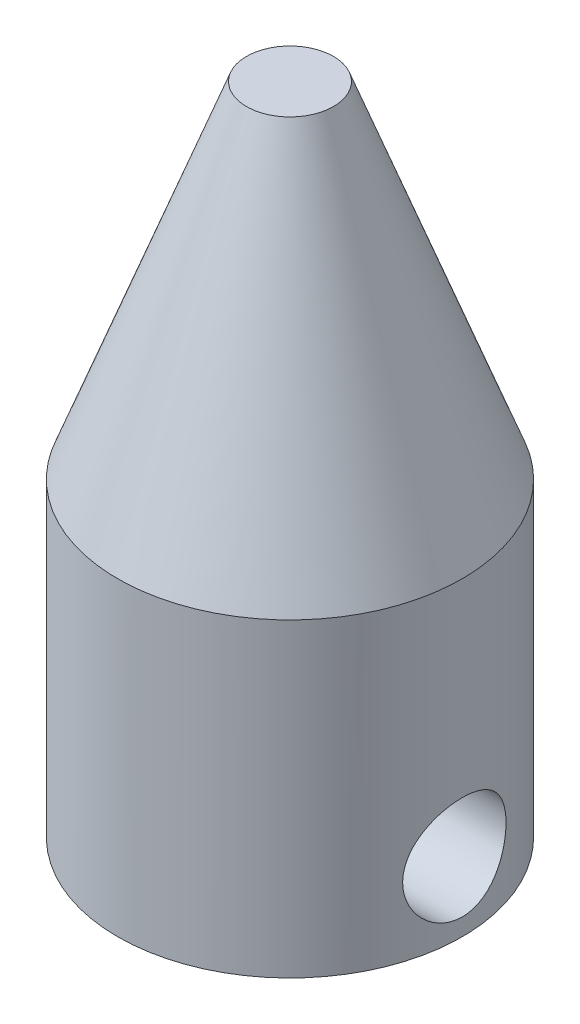
from build123d import *

# Parameters (mm, degrees)
SKETCH1_R             = 5
BODY_DEPTH            = 9
PIN_INSERT_DEPTH      = 12.445523142
PIN_INSERT_DEPTH_BACK = 12.445523142
SKETCH2_R             = 1.5
HEAD_SA_R             = 1.262


with BuildPart() as part:
    # Sketch1 → body (new body)
    with BuildSketch(Plane(origin=(0, 0, 0), x_dir=(1, 0, 0), z_dir=(0, 1, 0))):
        with Locations(Location((0, 0, 0), (0, 0, 270))):
            Circle(SKETCH1_R)
    extrude(amount=BODY_DEPTH)

    # Sketch2 → pin insert (cut, two sides: drawn at the far end of the back side and taken through both)
    with BuildSketch(Plane(origin=(0, 0, 0), x_dir=(0, 0, -1), z_dir=(1, 0, 0)).offset(-PIN_INSERT_DEPTH_BACK)):
        with Locations((0, 2)):
            Circle(SKETCH2_R)
    extrude(amount=PIN_INSERT_DEPTH + PIN_INSERT_DEPTH_BACK, mode=Mode.SUBTRACT)

    # head SA → section 0 of cone
    with BuildSketch(Plane(origin=(0, 19, 0), x_dir=(1, 0, 0), z_dir=(0, 1, 0)), mode=Mode.PRIVATE) as cone_s0:
        Circle(HEAD_SA_R)
    # loft up to a face of the part (cone)
    loft([cone_s0.sketch, part.faces().sort_by_distance((0, 9, 0))[0]])


solid = part.part
